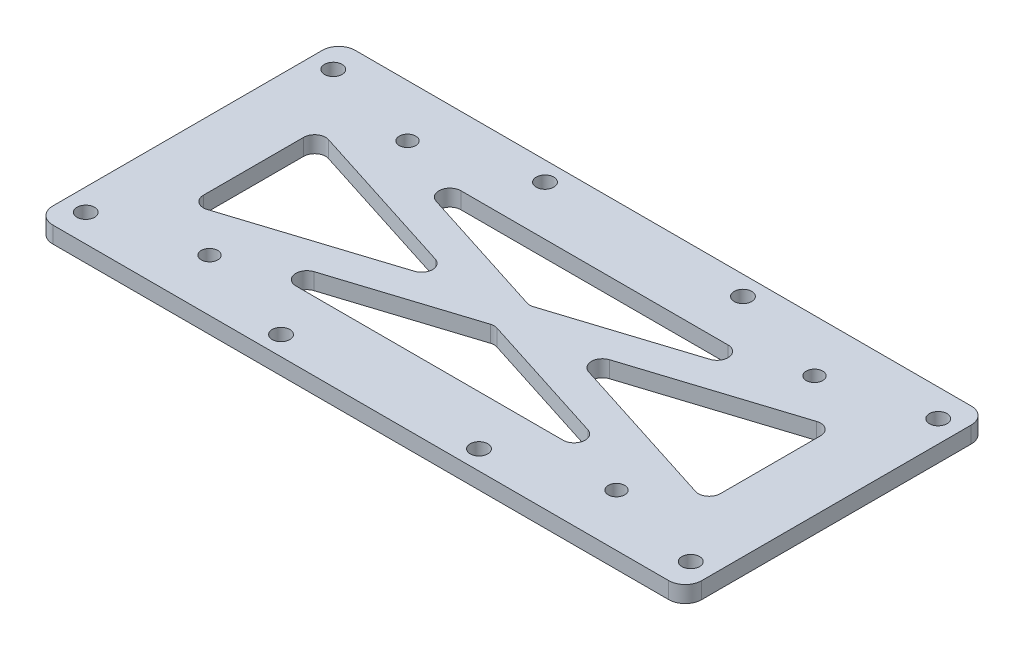
from build123d import *

# Parameters (mm, degrees)
SKETCH_1_W          = 118
SKETCH_1_H          = 55
SKETCH_1_R          = 1.6
EXTRUDE_1_DEPTH     = 3
SKETCH_2_R          = 1.5
CUT_EXTRUDE_1_DEPTH = 66.163256518
CUT_EXTRUDE_2_DEPTH = 66.163256518
FILLET_1_R          = 2
FILLET_2_R          = 3


with BuildPart() as part:
    # 草图1 → 凸台-拉伸1 (new body)
    with BuildSketch(Plane(origin=(0, 0, 0), x_dir=(1, 0, 0), z_dir=(0, 1, 0))):
        Rectangle(SKETCH_1_W, SKETCH_1_H)
        with Locations(Location((-55, 22.5, 0), (0, 0, 270))):
            Circle(SKETCH_1_R, mode=Mode.SUBTRACT)
        with Locations(Location((55, 22.5, 0), (0, 0, 270))):
            Circle(SKETCH_1_R, mode=Mode.SUBTRACT)
        with Locations(Location((-55, -22.5, 0), (0, 0, 270))):
            Circle(SKETCH_1_R, mode=Mode.SUBTRACT)
        with Locations(Location((55, -22.5, 0), (0, 0, 270))):
            Circle(SKETCH_1_R, mode=Mode.SUBTRACT)
        with Locations(Location((-18, 24, 0), (0, 0, 270))):
            Circle(SKETCH_1_R, mode=Mode.SUBTRACT)
        with Locations(Location((18, 24, 0), (0, 0, 270))):
            Circle(SKETCH_1_R, mode=Mode.SUBTRACT)
        with Locations(Location((18, -24, 0), (0, 0, 270))):
            Circle(SKETCH_1_R, mode=Mode.SUBTRACT)
        with Locations(Location((-18, -24, 0), (0, 0, 270))):
            Circle(SKETCH_1_R, mode=Mode.SUBTRACT)
    extrude(amount=EXTRUDE_1_DEPTH)

    # 草图2 → 切除-拉伸1 (cut, through all)
    with BuildSketch(Plane(origin=(0, 3, 0), x_dir=(1, 0, 0), z_dir=(0, 1, 0))):
        with Locations(Location((-37, 18, 0), (0, 0, 270))):
            Circle(SKETCH_2_R)
        with Locations(Location((37, 18, 0), (0, 0, 270))):
            Circle(SKETCH_2_R)
        with Locations(Location((37, -18, 0), (0, 0, 270))):
            Circle(SKETCH_2_R)
        with Locations(Location((-37, -18, 0), (0, 0, 270))):
            Circle(SKETCH_2_R)
    extrude(amount=-CUT_EXTRUDE_1_DEPTH, mode=Mode.SUBTRACT)

    # 草图3 → 切除-拉伸2 (cut, through all)
    with BuildSketch(Plane(origin=(0, 3, 0), x_dir=(1, 0, 0), z_dir=(0, 1, 0))):
        Polygon((-47, -11.850920072), (-9.867117107, 0), (-47, 11.850920072), align=None)
        Polygon((-37.132882893, 15), (0, 3.149079928), (37.132882893, 15), align=None)
        Polygon((9.867117107, 0), (47, -11.850920072), (47, 11.850920072), align=None)
        Polygon((-37.132882893, -15), (37.132882893, -15), (0, -3.149079928), align=None)
    extrude(amount=-CUT_EXTRUDE_2_DEPTH, mode=Mode.SUBTRACT)

    # 圆角1
    fillet_1_edges = [part.edges().sort_by_distance(p)[0] for p in [
        (47, 1.5, -11.850920072),
        (47, 1.5, 11.850920072),
        (9.867117107, 1.5, 0),
        (37.132882893, 1.5, -15),
        (0, 1.5, -3.149079928),
        (-37.132882893, 1.5, -15),
        (0, 1.5, 3.149079928),
        (37.132882893, 1.5, 15),
        (-37.132882893, 1.5, 15),
        (-9.867117107, 1.5, 0),
        (-47, 1.5, 11.850920072),
        (-47, 1.5, -11.850920072),
    ]]
    fillet(fillet_1_edges, radius=FILLET_1_R)

    # 圆角2
    fillet_2_edges = [part.edges().sort_by_distance(p)[0] for p in [
        (-59, 1.5, -27.5),
        (59, 1.5, -27.5),
        (59, 1.5, 27.5),
        (-59, 1.5, 27.5),
    ]]
    fillet(fillet_2_edges, radius=FILLET_2_R)


solid = part.part
